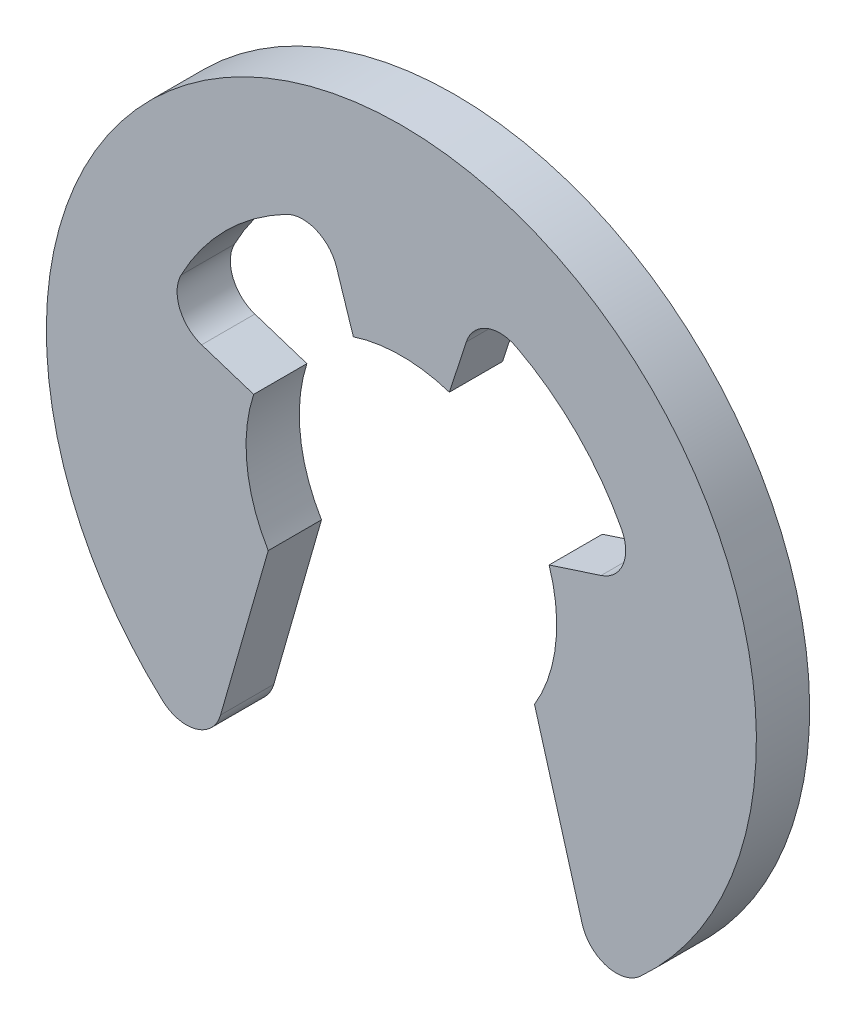
from build123d import *

# Parameters (mm, degrees)
BODY_DEPTH = 0.6


with BuildPart() as part:
    # Sketch1 → Body (new body)
    with BuildSketch(Plane.XY):
        with BuildLine():
            Line((0.731267677, 2.250610491), (0.54077974, 1.664348904))
            ThreePointArc((0.54077974, 1.664348904), (0, 1.75), (-0.54077974, 1.664348904))
            Line((-0.54077974, 1.664348904), (-0.731267677, 2.250610491))
            ThreePointArc((-0.731267677, 2.250610491), (-0.960534798, 2.497344104), (-1.296971998, 2.481504309))
            ThreePointArc((-1.296971998, 2.481504309), (-1.979898987, 1.979898987), (-2.481504309, 1.296971998))
            ThreePointArc((-2.481504309, 1.296971998), (-2.497344104, 0.960534798), (-2.250610491, 0.731267677))
            Line((-2.250610491, 0.731267677), (-1.664348904, 0.54077974))
            ThreePointArc((-1.664348904, 0.54077974), (-1.738746046, -0.198146883), (-1.5, -0.901387819))
            Line((-1.5, -0.901387819), (-2.037003761, -2.774142492))
            ThreePointArc((-2.037003761, -2.774142492), (-2.312163951, -3.048652131), (-2.690564933, -2.959875055))
            ThreePointArc((-2.690564933, -2.959875055), (0, 4), (2.690564933, -2.959875055))
            ThreePointArc((2.690564933, -2.959875055), (2.312163951, -3.048652131), (2.037003761, -2.774142492))
            Line((2.037003761, -2.774142492), (1.5, -0.901387819))
            ThreePointArc((1.5, -0.901387819), (1.738746046, -0.198146883), (1.664348904, 0.54077974))
            Line((1.664348904, 0.54077974), (2.250610491, 0.731267677))
            ThreePointArc((2.250610491, 0.731267677), (2.497344104, 0.960534798), (2.481504309, 1.296971998))
            ThreePointArc((2.481504309, 1.296971998), (1.979898987, 1.979898987), (1.296971998, 2.481504309))
            ThreePointArc((1.296971998, 2.481504309), (0.960534798, 2.497344104), (0.731267677, 2.250610491))
        make_face()
    extrude(amount=-BODY_DEPTH)


solid = part.part
